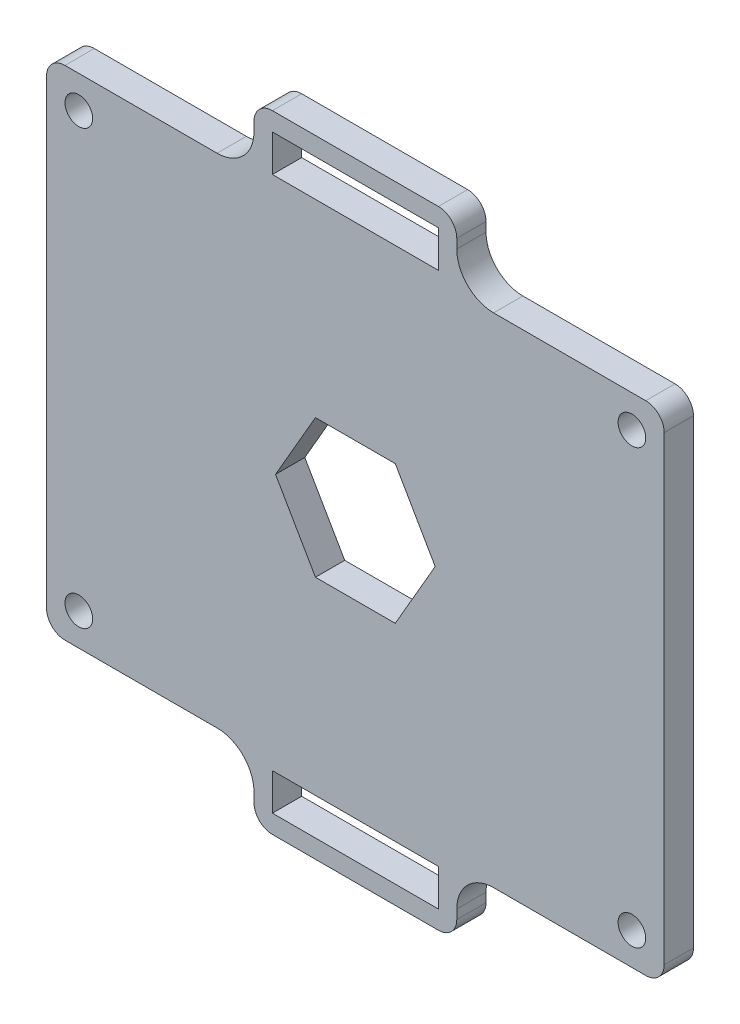
from build123d import *

# Parameters (mm, degrees)
SKETCH1_R           = 1.5
SKETCH1_W           = 18
SKETCH1_H           = 4
BOSS_EXTRUDE1_DEPTH = 3.175
FILLET1_R           = 4
FILLET2_R           = 2


with BuildPart() as part:
    # Sketch1 → Boss-Extrude1 (new body)
    with BuildSketch(Plane.XY):
        Polygon((-33.5, 27), (-11, 27), (-11, 34), (11, 34), (11, 27), (33.5, 27), (33.5, -27), (11, -27), (11, -34), (-11, -34), (-11, -27), (-33.5, -27), align=None)
        with Locations((-30, 23.5)):
            Circle(SKETCH1_R, mode=Mode.SUBTRACT)
        with Locations((30, 23.5)):
            Circle(SKETCH1_R, mode=Mode.SUBTRACT)
        with Locations((30, -23.5)):
            Circle(SKETCH1_R, mode=Mode.SUBTRACT)
        with Locations((-30, -23.5)):
            Circle(SKETCH1_R, mode=Mode.SUBTRACT)
        with Locations((0, -30)):
            Rectangle(SKETCH1_W, SKETCH1_H, mode=Mode.SUBTRACT)
        with Locations((0, 30)):
            Rectangle(SKETCH1_W, SKETCH1_H, mode=Mode.SUBTRACT)
        Polygon((8.660254038, 0), (4.330127019, 7.5), (-4.330127019, 7.5), (-8.660254038, 0), (-4.330127019, -7.5), (4.330127019, -7.5), align=None, mode=Mode.SUBTRACT)
    extrude(amount=BOSS_EXTRUDE1_DEPTH)

    # Fillet1
    fillet1_edges = [part.edges().sort_by_distance(p)[0] for p in [
        (-11, 27, 1.5875),
        (11, 27, 1.5875),
        (11, -27, 1.5875),
        (-11, -27, 1.5875),
    ]]
    fillet(fillet1_edges, radius=FILLET1_R)

    # Fillet2
    fillet2_edges = [part.edges().sort_by_distance(p)[0] for p in [
        (-33.5, 27, 1.5875),
        (-11, 34, 1.5875),
        (11, 34, 1.5875),
        (33.5, 27, 1.5875),
        (33.5, -27, 1.5875),
        (11, -34, 1.5875),
        (-11, -34, 1.5875),
        (-33.5, -27, 1.5875),
    ]]
    fillet(fillet2_edges, radius=FILLET2_R)


solid = part.part
